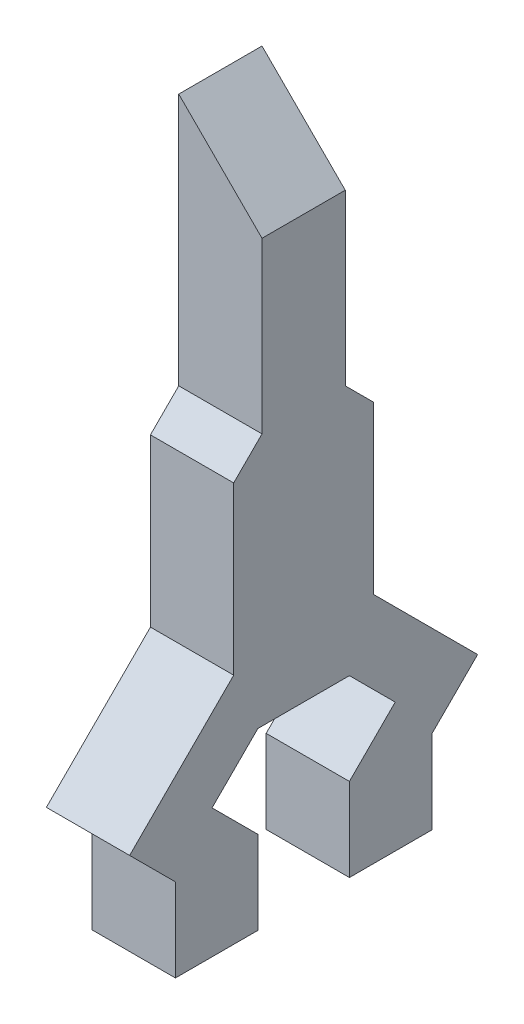
from build123d import *

# Parameters (mm, degrees)
BOSS_EXTRUDE1_DEPTH = 10
BOSS_EXTRUDE2_DEPTH = 5


with BuildPart() as part:
    # Sketch1 → Boss-Extrude1 (new body)
    with BuildSketch(Plane(origin=(0, 0, 0), x_dir=(0, 0, -1), z_dir=(1, 0, 0))):
        Polygon((5.5, 5.5), (11, 0), (5.5, -5.5), (5.5, -15.5), (15.399494937, -15.5), (15.399494937, -5.5), (20.899494937, 0), (8.399494937, 12.5), (8.399494937, 32.5), (0, 40.899494937), (-8.399494937, 32.5), (-8.399494937, 12.5), (-20.899494937, 0), (-15.399494937, -5.5), (-15.399494937, -15.5), (-5.5, -15.5), (-5.5, -5.5), (-11, 0), (-5.5, 5.5), align=None)
    extrude(amount=BOSS_EXTRUDE1_DEPTH)

    # Sketch2 → Boss-Extrude2 (add, symmetric)
    with BuildSketch(Plane.XY):
        Polygon((0, 6.25), (0, 66.25), (10, 56.25), (10, 6.25), align=None)
    extrude(amount=BOSS_EXTRUDE2_DEPTH, both=True)


solid = part.part
